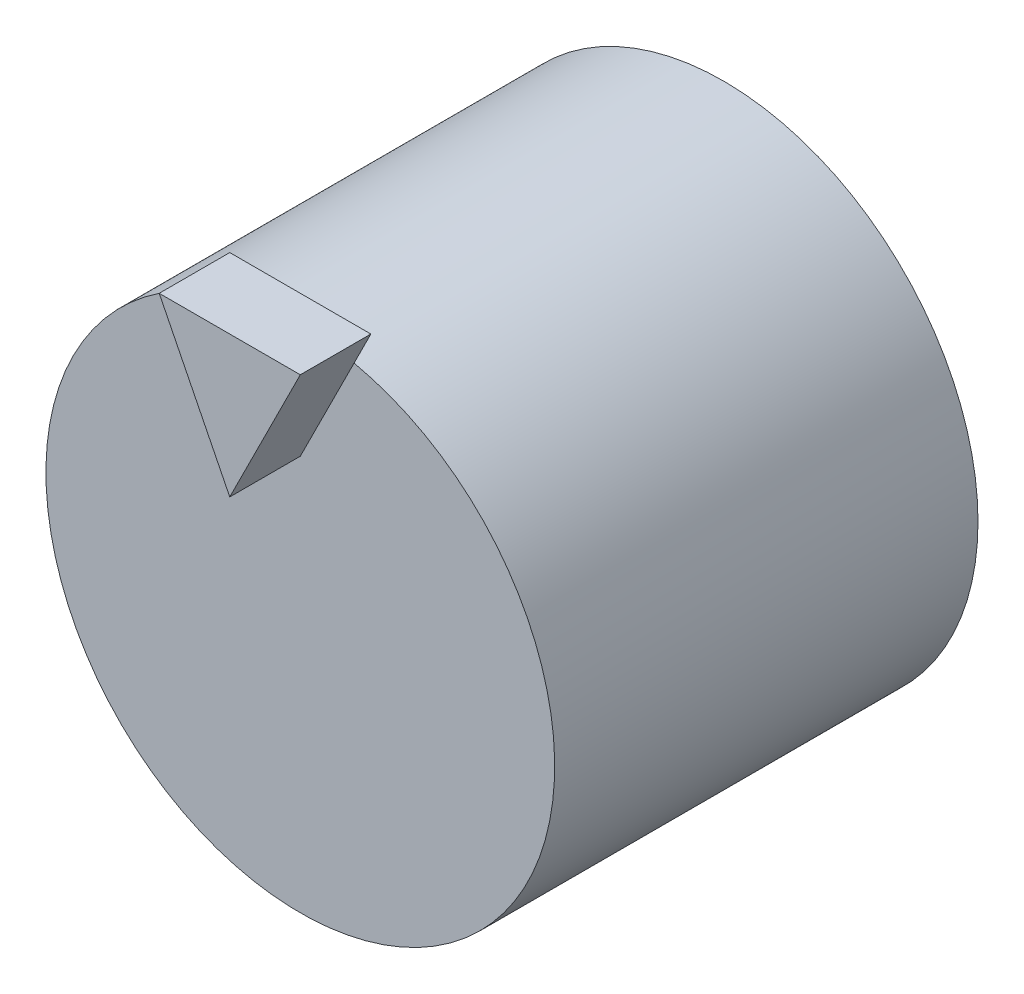
from build123d import *

# Parameters (mm, degrees)
SKETCH1_R           = 36.055512755
BOSS_EXTRUDE1_DEPTH = 60
BOSS_EXTRUDE2_DEPTH = 10


with BuildPart() as part:
    # Sketch1 → Boss-Extrude1 (new body)
    with BuildSketch(Plane.XY):
        Circle(SKETCH1_R)
    extrude(amount=BOSS_EXTRUDE1_DEPTH)

    # Sketch3 → Boss-Extrude2 (add)
    with BuildSketch(Plane.XY.offset(60)):
        Polygon((-10, 40), (0, 20), (10, 40), align=None)
    extrude(amount=BOSS_EXTRUDE2_DEPTH)


solid = part.part
